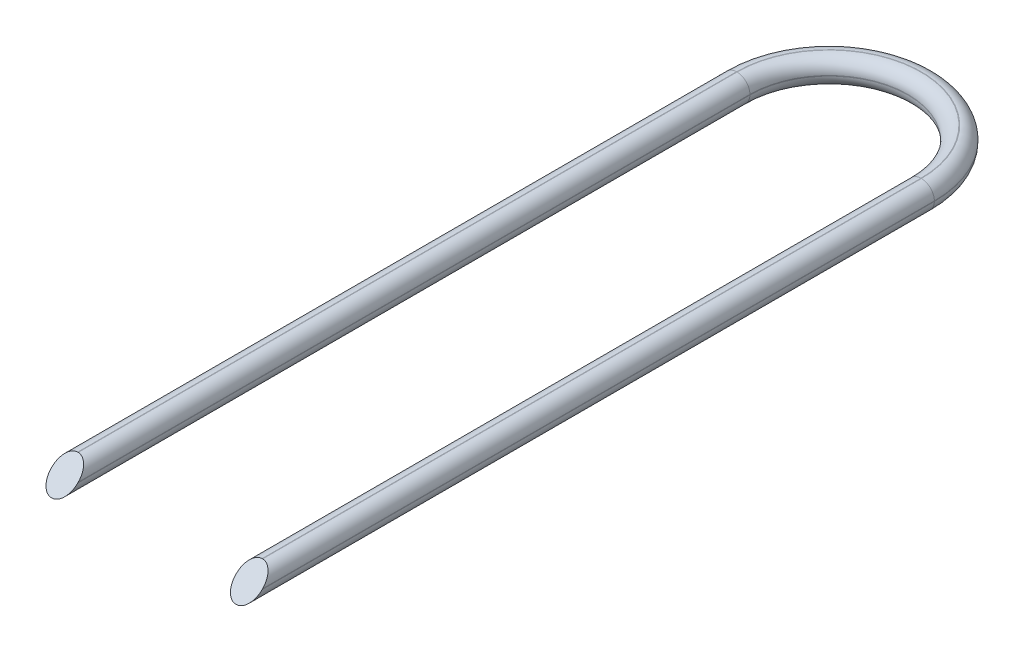
from build123d import *

# Parameters (mm, degrees)
CUT_EXTRUDE_1_DEPTH = 156.307191324


with BuildPart() as part:
    # По траектории1: sweep along a path in Эскиз2
    with BuildLine(Plane(origin=(0, 0, 0), x_dir=(1, 0, 0), z_dir=(0, 1, 0))) as sweep_1_path:
        Line((-19.053699061, 0), (-19.053699061, 130))
        ThreePointArc((-19.053699061, 130), (-1.553699061, 147.5), (15.946300939, 130))
        Line((15.946300939, 130), (15.946300939, 0))
    # Эскиз1 → По траектории1 (sweep)
    with BuildSketch(Plane.XY):
        with BuildLine():
            Line((-19.103699061, 0.491825411), (-19.003699061, 0.491825411))
            ThreePointArc((-19.003699061, 0.491825411), (-17.271287447, -0.225762975), (-16.553699061, -1.958174589))
            Line((-16.553699061, -1.958174589), (-16.553699061, -2.058174589))
            ThreePointArc((-16.553699061, -2.058174589), (-17.271287447, -3.790586203), (-19.003699061, -4.508174589))
            Line((-19.003699061, -4.508174589), (-19.103699061, -4.508174589))
            ThreePointArc((-19.103699061, -4.508174589), (-20.836110675, -3.790586203), (-21.553699061, -2.058174589))
            Line((-21.553699061, -2.058174589), (-21.553699061, -1.958174589))
            ThreePointArc((-21.553699061, -1.958174589), (-20.836110675, -0.225762975), (-19.103699061, 0.491825411))
        make_face()
    sweep(path=sweep_1_path.line)

    # Эскиз3 → Вырез-Вытянуть1 (cut, through all)
    with BuildSketch(Plane.ZY.offset(21.553699061)):
        Polygon((0, 0.491825411), (-5, 0.491825411), (0, -4.508174589), align=None)
    extrude(amount=-CUT_EXTRUDE_1_DEPTH, mode=Mode.SUBTRACT)


solid = part.part
